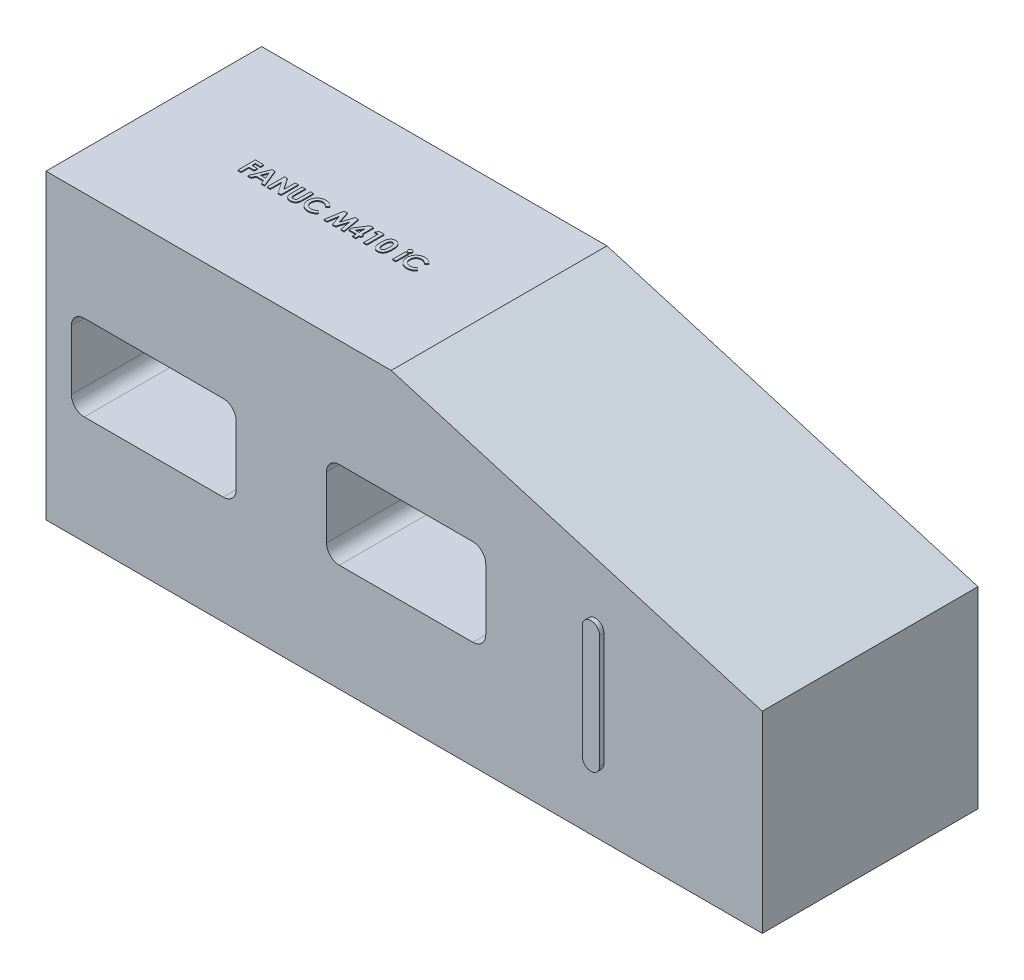
from build123d import *

# Parameters (mm, degrees)
SKETCH1_W           = 400
SKETCH1_H           = 250
BOSS_EXTRUDE1_DEPTH = 350
BOSS_EXTRUDE2_DEPTH = 250
BOSS_EXTRUDE3_DEPTH = 5
CUT_EXTRUDE1_DEPTH  = 490
SKETCH6_W           = 3.58974359
SKETCH6_H           = 14.615384616
BOSS_EXTRUDE4_DEPTH = 1


with BuildPart() as part:
    # Sketch1 → Boss-Extrude1 (new body)
    with BuildSketch(Plane(origin=(0, 0, 0), x_dir=(1, 0, 0), z_dir=(0, 1, 0))):
        with Locations((-200, 125)):
            Rectangle(SKETCH1_W, SKETCH1_H)
    extrude(amount=-BOSS_EXTRUDE1_DEPTH)

    # Sketch2 → Boss-Extrude2 (add)
    with BuildSketch(Plane.XY):
        Polygon((0, 0), (430, -127), (430, -350), (0, -350), align=None)
    extrude(amount=-BOSS_EXTRUDE2_DEPTH)

    # Sketch3 → Boss-Extrude3 (add)
    with BuildSketch(Plane.XY):
        with BuildLine():
            Line((246.478180257, -140.273477439), (246.478180257, -271.584843145))
            ThreePointArc((246.478180257, -271.584843145), (236.478180257, -281.584843145), (226.478180257, -271.584843145))
            Line((226.478180257, -271.584843145), (226.478180257, -140.273477439))
            ThreePointArc((226.478180257, -140.273477439), (236.478180257, -130.273477439), (246.478180257, -140.273477439))
        make_face()
    extrude(amount=BOSS_EXTRUDE3_DEPTH)

    # Sketch4 → Cut-Extrude1 (cut)
    with BuildSketch(Plane.XY):
        with BuildLine():
            Line((-355.609736241, -125.497461916), (-194.679619459, -125.497461916))
            ThreePointArc((-194.679619459, -125.497461916), (-184.073017741, -129.890860199), (-179.679619459, -140.497461916))
            Line((-179.679619459, -140.497461916), (-179.679619459, -209.502538084))
            ThreePointArc((-179.679619459, -209.502538084), (-184.073017741, -220.109139801), (-194.679619459, -224.502538084))
            Line((-194.679619459, -224.502538084), (-355.609736241, -224.502538084))
            ThreePointArc((-355.609736241, -224.502538084), (-366.216337958, -220.109139801), (-370.609736241, -209.502538084))
            Line((-370.609736241, -209.502538084), (-370.609736241, -140.497461916))
            ThreePointArc((-370.609736241, -140.497461916), (-366.216337958, -129.890860199), (-355.609736241, -125.497461916))
        make_face()
        with BuildLine():
            Line((-60.039815488, -124.499486523), (94.584219321, -124.499486523))
            ThreePointArc((94.584219321, -124.499486523), (105.190821039, -128.892884806), (109.584219321, -139.499486523))
            Line((109.584219321, -139.499486523), (109.584219321, -210.500513477))
            ThreePointArc((109.584219321, -210.500513477), (105.190821039, -221.107115194), (94.584219321, -225.500513477))
            Line((94.584219321, -225.500513477), (-60.039815488, -225.500513477))
            ThreePointArc((-60.039815488, -225.500513477), (-70.646417205, -221.107115194), (-75.039815488, -210.500513477))
            Line((-75.039815488, -210.500513477), (-75.039815488, -139.499486523))
            ThreePointArc((-75.039815488, -139.499486523), (-70.646417205, -128.892884806), (-60.039815488, -124.499486523))
        make_face()
    extrude(amount=-CUT_EXTRUDE1_DEPTH, mode=Mode.SUBTRACT)

    # Sketch6 → Boss-Extrude4 (add)
    # profile 1 of 12: a face of its own
    with BuildSketch(Plane(origin=(0, 0, 0), x_dir=(1, 0, 0), z_dir=(0, 1, 0))):
        Polygon((-288.973743059, 131.537887531), (-279.230153315, 131.537887531), (-279.230153315, 127.948143942), (-285.383999469, 127.948143942), (-285.383999469, 124.101990095), (-279.230153315, 124.101990095), (-279.230153315, 120.512246506), (-285.383999469, 120.512246506), (-285.383999469, 111.537887531), (-288.973743059, 111.537887531), align=None)
    # profile 2 of 12: a face of its own
    with BuildSketch(Plane(origin=(0, 0, 0), x_dir=(1, 0, 0), z_dir=(0, 1, 0))):
        Polygon((-269.482557162, 131.537887531), (-266.153230238, 131.537887531), (-258.076307162, 111.537887531), (-261.910441777, 111.537887531), (-263.464928956, 115.640451634), (-272.178871264, 115.640451634), (-273.733358444, 111.537887531), (-277.563486649, 111.537887531), align=None)
        Polygon((-267.819896905, 126.173304198), (-270.816691777, 119.230195224), (-264.823102033, 119.230195224), align=None, mode=Mode.SUBTRACT)
    # profile 3 of 12: a face of its own
    with BuildSketch(Plane(origin=(0, 0, 0), x_dir=(1, 0, 0), z_dir=(0, 1, 0))):
        Polygon((-255.127589213, 131.537887531), (-251.894416136, 131.537887531), (-242.819896905, 118.376829839), (-242.819896905, 131.537887531), (-239.230153315, 131.537887531), (-239.230153315, 111.537887531), (-242.487364854, 111.537887531), (-251.537845623, 124.658881121), (-251.537845623, 111.537887531), (-255.127589213, 111.537887531), align=None)
    # profile 4 of 12: a face of its own
    with BuildSketch(Plane(origin=(0, 0, 0), x_dir=(1, 0, 0), z_dir=(0, 1, 0))):
        with BuildLine():
            Line((-234.6147687, 131.537887531), (-231.02502511, 131.537887531))
            Line((-231.02502511, 131.537887531), (-231.02502511, 118.525067019))
            add(Edge.make_bspline(
                [(-231.02502511, 118.525067019), (-231.024829918, 118.39015574), (-231.024452905, 118.129575998), (-231.005579468, 117.755729384), (-230.988308972, 117.41208607), (-230.957148094, 117.099022273), (-230.911112798, 116.816404075), (-230.866535609, 116.562416037), (-230.806204792, 116.341605527), (-230.71553722, 116.090265358), (-230.575848255, 115.80787095), (-230.347604236, 115.513553019), (-230.084230164, 115.244945189), (-229.768561169, 115.021366208), (-229.413777136, 114.840510964), (-229.021827445, 114.706517243), (-228.593264605, 114.632034526), (-228.29693691, 114.620663375), (-228.144416136, 114.614810608)],
                knots=[0, 0, 0, 0, 1.155499968, 2.231836252, 3.205919964, 4.102923608, 4.924856345, 5.658536265, 6.31071849, 6.882491295, 7.94666036, 8.992281882, 10.060072772, 11.158554251, 12.289267114, 13.461410017, 14.693379945, 16, 16, 16, 16], degree=3))
            add(Edge.make_bspline(
                [(-228.144416136, 114.614810608), (-227.982381635, 114.619538892), (-227.666441793, 114.628758245), (-227.212012625, 114.719256177), (-226.790981425, 114.863359877), (-226.412262857, 115.069032582), (-226.076233809, 115.315567364), (-225.79179226, 115.596694273), (-225.567312035, 115.912974016), (-225.421004176, 116.204766163), (-225.338859518, 116.473335425), (-225.277288005, 116.713291869), (-225.232149275, 116.996416721), (-225.191197935, 117.318288376), (-225.166589334, 117.682240803), (-225.139905318, 118.085347051), (-225.130125379, 118.530365281), (-225.12845846, 118.840239826), (-225.127589213, 119.001829839)],
                knots=[0, 0, 0, 0, 1.261321664, 2.459363699, 3.594844139, 4.716940403, 5.803436589, 6.833651888, 7.818396249, 8.814403945, 9.360733334, 10.004355033, 10.743453831, 11.592799886, 12.532235708, 13.585170094, 14.740740724, 16, 16, 16, 16], degree=3))
            Line((-225.127589213, 119.001829839), (-225.127589213, 131.537887531))
            Line((-225.127589213, 131.537887531), (-221.537845623, 131.537887531))
            Line((-221.537845623, 131.537887531), (-221.537845623, 119.606797788))
            add(Edge.make_bspline(
                [(-221.537845623, 119.606797788), (-221.538344124, 119.36507448), (-221.539302693, 118.900264133), (-221.554023425, 118.232298955), (-221.585361199, 117.622219911), (-221.611681314, 117.069848738), (-221.662619751, 116.575929571), (-221.715685653, 116.138353234), (-221.78332271, 115.758670399), (-221.883962584, 115.326447633), (-222.057637212, 114.828758947), (-222.337623482, 114.255691999), (-222.69304793, 113.694624745), (-223.113141864, 113.151729312), (-223.587466344, 112.64739695), (-224.105504579, 112.204658416), (-224.65902623, 111.830149358), (-225.253815202, 111.533026974), (-225.889365298, 111.301293914), (-226.571964813, 111.14558097), (-227.301148268, 111.04037935), (-227.804809062, 111.03027344), (-228.064287931, 111.025067019)],
                knots=[0, 0, 0, 0, 1.170808336, 2.251350247, 3.235597562, 4.129743112, 4.929140599, 5.639994148, 6.264258765, 6.79612947, 7.788252245, 8.809469599, 9.879094798, 10.999557536, 12.129761673, 13.226370002, 14.293821979, 15.358369427, 16.438775801, 17.562147481, 18.744053101, 20, 20, 20, 20], degree=3))
            add(Edge.make_bspline(
                [(-228.064287931, 111.025067019), (-228.236690853, 111.027970918), (-228.576838282, 111.033700252), (-229.077084748, 111.084218014), (-229.560671225, 111.1586622), (-230.026689058, 111.267268601), (-230.476755706, 111.407567786), (-230.910751599, 111.580266312), (-231.327063901, 111.784400888), (-231.723362989, 112.018093919), (-232.099161182, 112.270792702), (-232.442621332, 112.550919941), (-232.76556271, 112.837759168), (-233.058655672, 113.143381795), (-233.324101609, 113.464579307), (-233.561353834, 113.802079642), (-233.77005987, 114.155852821), (-233.955469602, 114.532275586), (-234.114162237, 114.950480148), (-234.24794609, 115.425342213), (-234.364822812, 115.964304772), (-234.451678695, 116.568582078), (-234.530422749, 117.2361825), (-234.580263393, 117.96884524), (-234.606337278, 118.766591318), (-234.611887211, 119.319652136), (-234.6147687, 119.606797788)],
                knots=[0, 0, 0, 0, 1.001158378, 1.975264943, 2.917723546, 3.841610987, 4.75185031, 5.653588123, 6.552117133, 7.442167995, 8.324307438, 9.179605724, 10.014504199, 10.831958861, 11.636465792, 12.43274043, 13.225645099, 14.020104002, 14.867201867, 15.819789774, 16.883317127, 18.068162734, 19.364263498, 20.787406516, 22.332041935, 24, 24, 24, 24], degree=3))
            Line((-234.6147687, 119.606797788), (-234.6147687, 131.537887531))
        make_face()
    # profile 5 of 12: a face of its own
    with BuildSketch(Plane(origin=(0, 0, 0), x_dir=(1, 0, 0), z_dir=(0, 1, 0))):
        with BuildLine():
            Line((-198.973743059, 128.068336249), (-201.605954597, 125.552310608))
            add(Edge.make_bspline(
                [(-201.605954597, 125.552310608), (-201.829240224, 125.783188321), (-202.265387007, 126.234164825), (-202.968183606, 126.831217972), (-203.699066481, 127.328780987), (-204.443817763, 127.74782539), (-205.215833369, 128.064862346), (-206.006186697, 128.295892516), (-206.819924384, 128.436742879), (-207.370630752, 128.452858653), (-207.647621264, 128.460964454)],
                knots=[0, 0, 0, 0, 1.115251505, 2.178435587, 3.19620269, 4.182487026, 5.141301733, 6.088180966, 7.038406374, 8, 8, 8, 8], degree=3))
            add(Edge.make_bspline(
                [(-207.647621264, 128.460964454), (-207.878942003, 128.454560588), (-208.335427994, 128.441923263), (-209.00566905, 128.349279205), (-209.64678926, 128.191733952), (-210.260983279, 127.974607411), (-210.846443814, 127.69365719), (-211.404398356, 127.349100739), (-211.933471292, 126.944049891), (-212.426673875, 126.480600399), (-212.877838264, 125.974247003), (-213.27647073, 125.433969136), (-213.610389364, 124.861004546), (-213.884430955, 124.261155798), (-214.097898762, 123.631646493), (-214.250341595, 122.972900443), (-214.338510456, 122.284133132), (-214.351670249, 121.815914246), (-214.358358444, 121.577951634)],
                knots=[0, 0, 0, 0, 1.035432265, 2.043311493, 3.022114605, 3.98653278, 4.95457646, 5.923598177, 6.917315552, 7.932509744, 8.948865224, 9.949768934, 10.933144597, 11.912367597, 12.897413939, 13.903909035, 14.934704909, 16, 16, 16, 16], degree=3))
            add(Edge.make_bspline(
                [(-214.358358444, 121.577951634), (-214.356430982, 121.410932823), (-214.352631917, 121.081735316), (-214.311044423, 120.594760837), (-214.244078753, 120.122280466), (-214.147162837, 119.665009885), (-214.025968531, 119.22255282), (-213.883780014, 118.791092215), (-213.705406611, 118.376589885), (-213.507409443, 117.974231654), (-213.277141018, 117.59499637), (-213.028869177, 117.233364053), (-212.7596589, 116.891107389), (-212.467766496, 116.569625533), (-212.149083943, 116.273942527), (-211.811848005, 115.99516683), (-211.450369979, 115.740277144), (-211.072158681, 115.502876729), (-210.673946841, 115.29664497), (-210.26653887, 115.109838838), (-209.843757644, 114.958124485), (-209.410750776, 114.835828876), (-208.969065681, 114.731834725), (-208.514382268, 114.66780233), (-208.050642073, 114.619311347), (-207.73723154, 114.616317312), (-207.57951229, 114.614810608)],
                knots=[0, 0, 0, 0, 1.103660481, 2.175337485, 3.227646561, 4.255952547, 5.262355991, 6.258840057, 7.255597736, 8.242457506, 9.22035537, 10.185017736, 11.140346927, 12.096287581, 13.051739095, 14.01125915, 14.986044842, 15.97314143, 16.960198552, 17.947847494, 18.933482797, 19.925264591, 20.920966487, 21.929612487, 22.958107872, 24, 24, 24, 24], degree=3))
            add(Edge.make_bspline(
                [(-207.57951229, 114.614810608), (-207.311993336, 114.622548676), (-206.786388157, 114.637751967), (-206.014986981, 114.75663955), (-205.279918511, 114.952202896), (-204.692602322, 115.183151845), (-204.2324556, 115.411216929), (-203.882152703, 115.622165902), (-203.519912206, 115.858135488), (-203.151750612, 116.128031437), (-202.773526834, 116.428614888), (-202.391917395, 116.766469179), (-201.997153024, 117.130469254), (-201.738546798, 117.390263258), (-201.605954597, 117.523464454)],
                knots=[0, 0, 0, 0, 1.404581149, 2.759636711, 4.088442092, 5.392261763, 6.066678138, 6.783632037, 7.538459478, 8.336747902, 9.180226004, 10.074962426, 11.012997595, 12, 12, 12, 12], degree=3))
            Line((-201.605954597, 117.523464454), (-199.053871264, 114.843175993))
            add(Edge.make_bspline(
                [(-199.053871264, 114.843175993), (-199.233268986, 114.669973125), (-199.583414973, 114.331918167), (-200.111600474, 113.851911672), (-200.639121232, 113.420572476), (-201.153233446, 113.022244857), (-201.662358809, 112.668533066), (-202.16644333, 112.359083846), (-202.659780551, 112.086070778), (-203.152614777, 111.854098096), (-203.648012679, 111.657129196), (-204.157718902, 111.487551901), (-204.683291667, 111.344095611), (-205.227940933, 111.228345224), (-205.786586542, 111.135529041), (-206.364456677, 111.072878654), (-206.957887354, 111.030760883), (-207.360420576, 111.026976253), (-207.563486649, 111.025067019)],
                knots=[0, 0, 0, 0, 1.244526981, 2.429050516, 3.560637417, 4.644440555, 5.67424972, 6.652764056, 7.595344123, 8.486817594, 9.369275933, 10.254498637, 11.166417451, 12.086725134, 13.032340136, 13.991389299, 14.986715468, 16, 16, 16, 16], degree=3))
            add(Edge.make_bspline(
                [(-207.563486649, 111.025067019), (-207.936493871, 111.034575717), (-208.666365322, 111.053181595), (-209.735972903, 111.19103856), (-210.752071393, 111.422153334), (-211.717132769, 111.74901337), (-212.630850165, 112.166561747), (-213.492989824, 112.678456451), (-214.302162168, 113.283337458), (-215.051830677, 113.974114976), (-215.729941521, 114.737020755), (-216.329312979, 115.556172265), (-216.825113071, 116.435595336), (-217.236786571, 117.362298081), (-217.558709834, 118.340509404), (-217.785289236, 119.371287431), (-217.925019099, 120.453636883), (-217.940305745, 121.192906509), (-217.948102033, 121.569938813)],
                knots=[0, 0, 0, 0, 1.078019885, 2.10938526, 3.111377082, 4.085535484, 5.04941344, 6.010039228, 6.978205633, 7.964457913, 8.951525778, 9.924444315, 10.892603023, 11.863865945, 12.85144698, 13.863884204, 14.910567087, 16, 16, 16, 16], degree=3))
            add(Edge.make_bspline(
                [(-217.948102033, 121.569938813), (-217.9448077, 121.815836066), (-217.938279136, 122.303144321), (-217.869663322, 123.020988861), (-217.774008888, 123.720758885), (-217.622261827, 124.395188461), (-217.439345711, 125.0533634), (-217.211865488, 125.688130107), (-216.940184476, 126.301312968), (-216.633059593, 126.893938486), (-216.285612287, 127.46212433), (-215.897475502, 128.000988888), (-215.478641395, 128.514692095), (-215.019046063, 128.996418724), (-214.525368029, 129.450398429), (-213.995378393, 129.874171007), (-213.432264778, 130.273813834), (-212.834503045, 130.639021092), (-212.213706112, 130.969370469), (-211.577703862, 131.260752728), (-210.928058877, 131.504281197), (-210.267517917, 131.706279078), (-209.593290205, 131.857056213), (-208.910188205, 131.97118964), (-208.21239954, 132.034990956), (-207.743894903, 132.045435639), (-207.507396905, 132.050708044)],
                knots=[0, 0, 0, 0, 1.071919942, 2.124283339, 3.142214191, 4.149696895, 5.136002878, 6.119640489, 7.086990633, 8.058538607, 9.028339693, 9.988281803, 10.952401235, 11.916291999, 12.888973767, 13.874849856, 14.873389453, 15.898127285, 16.927174885, 17.938320013, 18.946391617, 19.950418109, 20.947802303, 21.956882652, 22.968648068, 24, 24, 24, 24], degree=3))
            add(Edge.make_bspline(
                [(-207.507396905, 132.050708044), (-207.305639864, 132.04768577), (-206.904223493, 132.041672644), (-206.306447156, 131.991546698), (-205.713451554, 131.912824408), (-205.127359794, 131.794049236), (-204.543979548, 131.653048097), (-203.970977086, 131.468426556), (-203.399312984, 131.262631056), (-202.837952946, 131.016644556), (-202.286113394, 130.748128072), (-201.75672204, 130.44348637), (-201.240890451, 130.121466759), (-200.750049146, 129.763010709), (-200.275003611, 129.381120086), (-199.818237899, 128.974013157), (-199.383760397, 128.534902253), (-199.111106441, 128.224644479), (-198.973743059, 128.068336249)],
                knots=[0, 0, 0, 0, 0.996412454, 1.982464992, 2.961075852, 3.949442424, 4.934965278, 5.923860011, 6.921385422, 7.934793307, 8.949617135, 9.951082467, 10.950285876, 11.951772932, 12.951063433, 13.960125323, 14.972308753, 16, 16, 16, 16], degree=3))
        make_face()
    # profile 6 of 12: a face of its own
    with BuildSketch(Plane(origin=(0, 0, 0), x_dir=(1, 0, 0), z_dir=(0, 1, 0))):
        Polygon((-186.109159726, 131.537887531), (-182.383198187, 131.537887531), (-177.819896905, 117.587567019), (-173.224544341, 131.537887531), (-169.534640495, 131.537887531), (-166.153230238, 111.537887531), (-169.787044341, 111.537887531), (-171.922461008, 124.17009907), (-176.081114854, 111.537887531), (-179.582717418, 111.537887531), (-183.717332803, 124.17009907), (-185.848743059, 111.537887531), (-189.486563572, 111.537887531), align=None)
    # profile 7 of 12: a face of its own
    with BuildSketch(Plane(origin=(0, 0, 0), x_dir=(1, 0, 0), z_dir=(0, 1, 0))):
        Polygon((-156.305473828, 132.050708044), (-152.563486649, 132.050708044), (-152.563486649, 118.973784967), (-150.768614854, 118.973784967), (-150.768614854, 115.640451634), (-152.563486649, 115.640451634), (-152.563486649, 111.537887531), (-156.153230238, 111.537887531), (-156.153230238, 115.640451634), (-164.6147687, 115.640451634), (-164.6147687, 119.274265737), align=None)
        Polygon((-156.153230238, 118.973784967), (-156.153230238, 125.780675993), (-160.580313572, 118.973784967), align=None, mode=Mode.SUBTRACT)
    # profile 8 of 12: a face of its own
    with BuildSketch(Plane(origin=(0, 0, 0), x_dir=(1, 0, 0), z_dir=(0, 1, 0))):
        Polygon((-145.291852033, 131.537887531), (-139.742973828, 131.537887531), (-139.742973828, 111.537887531), (-143.332717418, 111.537887531), (-143.332717418, 128.204554198), (-147.435281521, 128.204554198), align=None)
    # profile 9 of 12: a face of its own
    with BuildSketch(Plane(origin=(0, 0, 0), x_dir=(1, 0, 0), z_dir=(0, 1, 0))):
        with BuildLine():
            add(Edge.make_bspline(
                [(-126.854352033, 132.050708044), (-126.680593544, 132.04812855), (-126.33893793, 132.043056577), (-125.835743522, 131.988122968), (-125.351028183, 131.905133606), (-124.882895645, 131.789392385), (-124.434715575, 131.636213002), (-124.003226025, 131.452859906), (-123.59356297, 131.229715849), (-123.200501897, 130.977663177), (-122.824194213, 130.69230382), (-122.473684209, 130.36697942), (-122.14257083, 130.009175703), (-121.83802146, 129.613483321), (-121.55329176, 129.183501513), (-121.289317304, 128.7191621), (-121.048118883, 128.218192451), (-120.826993238, 127.679688525), (-120.629261987, 127.095578383), (-120.4627132, 126.459162027), (-120.319869746, 125.77029412), (-120.199299792, 125.027259966), (-120.108168394, 124.229071895), (-120.046743998, 123.376260183), (-120.004591669, 122.470468927), (-120.00115149, 121.849103567), (-119.999384085, 121.529874711)],
                knots=[0, 0, 0, 0, 0.879237366, 1.728815576, 2.559023295, 3.367336655, 4.166867292, 4.954216142, 5.737608147, 6.525189134, 7.316157332, 8.124696809, 8.942788509, 9.781158001, 10.649253743, 11.551476218, 12.482711956, 13.461909668, 14.496590415, 15.601789533, 16.789733467, 18.056700938, 19.410929216, 20.8549011, 22.384193279, 24, 24, 24, 24], degree=3))
            add(Edge.make_bspline(
                [(-119.999384085, 121.529874711), (-120.001294172, 121.206651943), (-120.005005438, 120.578635902), (-120.044991713, 119.664559818), (-120.113849968, 118.805556182), (-120.202599455, 118.001713862), (-120.324161977, 117.253457356), (-120.466528589, 116.558849182), (-120.635706298, 115.918141117), (-120.839950753, 115.332776815), (-121.05973792, 114.793327159), (-121.301596122, 114.293334282), (-121.561309805, 113.831443925), (-121.832921921, 113.400687844), (-122.131323243, 113.013764511), (-122.441989738, 112.657516508), (-122.778448382, 112.345513779), (-123.126532963, 112.061677104), (-123.498995228, 111.816385255), (-123.891994071, 111.601857049), (-124.312535981, 111.427849194), (-124.752955192, 111.276506456), (-125.220758739, 111.1678587), (-125.70851329, 111.081650276), (-126.221725493, 111.034006213), (-126.571141032, 111.028095654), (-126.750185367, 111.025067019)],
                knots=[0, 0, 0, 0, 1.643780988, 3.193836972, 4.651895693, 6.025988579, 7.305620092, 8.505800249, 9.631074763, 10.672816429, 11.65661981, 12.592235626, 13.49536222, 14.350718032, 15.179365177, 15.97804903, 16.751647189, 17.51006938, 18.259804725, 19.016521909, 19.783502495, 20.571750527, 21.382245291, 22.22305063, 23.089471752, 24, 24, 24, 24], degree=3))
            add(Edge.make_bspline(
                [(-126.750185367, 111.025067019), (-126.929224869, 111.028154074), (-127.279960622, 111.03420157), (-127.794560601, 111.081296022), (-128.284900006, 111.168207932), (-128.756404631, 111.277340573), (-129.20579288, 111.427514333), (-129.635219556, 111.606728379), (-130.041382738, 111.819918036), (-130.425407029, 112.065781391), (-130.785981261, 112.347718984), (-131.128708756, 112.662715177), (-131.452831379, 113.009971536), (-131.753418422, 113.393377618), (-132.035392632, 113.807815753), (-132.295813462, 114.258018621), (-132.534524408, 114.74333074), (-132.758992391, 115.264428583), (-132.954026655, 115.83253079), (-133.127598094, 116.452710441), (-133.269783251, 117.130137245), (-133.384138069, 117.864593573), (-133.47543889, 118.654523445), (-133.543356207, 119.500308138), (-133.583564587, 120.402341599), (-133.587236933, 121.022354129), (-133.589127674, 121.341573429)],
                knots=[0, 0, 0, 0, 0.917216111, 1.796812873, 2.643793957, 3.46689424, 4.273913431, 5.068098542, 5.848489301, 6.620921603, 7.401012384, 8.190319798, 9.003608147, 9.831726257, 10.68377682, 11.569763213, 12.493818149, 13.453288342, 14.474581811, 15.568529029, 16.750744269, 18.018426408, 19.375425659, 20.823733699, 22.36466933, 24, 24, 24, 24], degree=3))
            add(Edge.make_bspline(
                [(-133.589127674, 121.341573429), (-133.585702772, 121.785103516), (-133.57909438, 122.640900533), (-133.495347978, 123.8772784), (-133.372429501, 125.020095566), (-133.191891374, 126.06744038), (-132.968658477, 127.023191901), (-132.682797129, 127.88105414), (-132.357364779, 128.652897542), (-132.080054608, 129.110142221), (-131.946499469, 129.33035548)],
                knots=[0, 0, 0, 0, 1.288568992, 2.486310467, 3.599230591, 4.627010532, 5.572937695, 6.447898582, 7.252493626, 8, 8, 8, 8], degree=3))
            add(Edge.make_bspline(
                [(-131.946499469, 129.33035548), (-131.791207915, 129.546692917), (-131.487582327, 129.969675235), (-130.9566845, 130.524971953), (-130.386303906, 130.999888898), (-129.764725254, 131.383678275), (-129.101779069, 131.686334608), (-128.391773621, 131.900097368), (-127.63733084, 132.024645512), (-127.119242398, 132.041890802), (-126.854352033, 132.050708044)],
                knots=[0, 0, 0, 0, 1.058512271, 2.069600068, 3.047294572, 4.004278952, 4.967380941, 5.939006123, 6.946246673, 8, 8, 8, 8], degree=3))
        make_face()
        with BuildLine():
            add(Edge.make_bspline(
                [(-126.766211008, 128.460964454), (-126.923290123, 128.453519217), (-127.23124857, 128.438922599), (-127.678110951, 128.315017904), (-128.099474276, 128.123640423), (-128.419994103, 127.893347546), (-128.659900005, 127.672584207), (-128.827523979, 127.472800564), (-128.989170884, 127.249856418), (-129.131945569, 126.993691444), (-129.266762142, 126.713509953), (-129.398518571, 126.40804009), (-129.506524245, 126.069778853), (-129.612636956, 125.704486875), (-129.705601593, 125.302064802), (-129.783485577, 124.85922328), (-129.853068072, 124.373082468), (-129.901602691, 123.843323943), (-129.946851522, 123.270501965), (-129.979288027, 122.653340506), (-129.992848915, 121.992006066), (-129.997159509, 121.536554851), (-129.999384085, 121.301509326)],
                knots=[0, 0, 0, 0, 1.076674018, 2.110852608, 3.161083442, 4.239746716, 4.804137807, 5.395870207, 6.026861976, 6.692161227, 7.405688833, 8.16177676, 8.973626916, 9.841385931, 10.773283133, 11.807421078, 12.927755683, 14.143907515, 15.458935494, 16.872852025, 18.386167141, 20, 20, 20, 20], degree=3))
            add(Edge.make_bspline(
                [(-129.999384085, 121.301509326), (-129.995722703, 120.996996486), (-129.988701731, 120.413070539), (-129.951929165, 119.573364693), (-129.878221607, 118.809164759), (-129.786544287, 118.11529147), (-129.657779748, 117.49624478), (-129.50962781, 116.946167933), (-129.326673339, 116.472073073), (-129.115234197, 116.067103723), (-128.88105582, 115.722597139), (-128.626844889, 115.42976499), (-128.361256378, 115.176186165), (-128.076000404, 114.97020721), (-127.771757502, 114.812354435), (-127.451067543, 114.698812882), (-127.11372673, 114.62930937), (-126.88271922, 114.619671467), (-126.766211008, 114.614810608)],
                knots=[0, 0, 0, 0, 1.771748488, 3.397459088, 4.888034009, 6.237357457, 7.467047327, 8.564189669, 9.548206622, 10.417051504, 11.216568818, 11.965764335, 12.669334354, 13.348544111, 14.005342236, 14.656555988, 15.322436492, 16, 16, 16, 16], degree=3))
            add(Edge.make_bspline(
                [(-126.766211008, 114.614810608), (-126.653700988, 114.618136769), (-126.433420361, 114.624648978), (-126.112201872, 114.691495925), (-125.808434844, 114.800174542), (-125.523036445, 114.953908075), (-125.254985844, 115.149403785), (-125.005593107, 115.387520762), (-124.776739105, 115.670632478), (-124.643407724, 115.880743243), (-124.574704597, 115.989009326)],
                knots=[0, 0, 0, 0, 0.992283464, 1.942767638, 2.88273346, 3.832339453, 4.79467288, 5.803907806, 6.868395428, 8, 8, 8, 8], degree=3))
            add(Edge.make_bspline(
                [(-124.574704597, 115.989009326), (-124.493818237, 116.136951469), (-124.324206098, 116.447174146), (-124.127930638, 116.970663346), (-123.962716896, 117.561072642), (-123.820519843, 118.220239445), (-123.723265734, 118.950763589), (-123.639510613, 119.748012759), (-123.599113437, 120.616001577), (-123.592542617, 121.217347362), (-123.589127674, 121.529874711)],
                knots=[0, 0, 0, 0, 0.710965849, 1.490837728, 2.352621235, 3.297892224, 4.334225155, 5.461620853, 6.680770821, 8, 8, 8, 8], degree=3))
            add(Edge.make_bspline(
                [(-123.589127674, 121.529874711), (-123.590446793, 121.845114948), (-123.592985871, 122.451898591), (-123.639570596, 123.32300789), (-123.704443386, 124.118621661), (-123.799333549, 124.836963623), (-123.921426991, 125.479777595), (-124.07190762, 126.047021555), (-124.249313087, 126.539813432), (-124.459694829, 126.957661845), (-124.692705679, 127.312775677), (-124.94005381, 127.6174358), (-125.20278511, 127.877546926), (-125.480460207, 128.0940879), (-125.779505988, 128.259541445), (-126.094210288, 128.376365334), (-126.425218276, 128.44703987), (-126.651012584, 128.456260277), (-126.766211008, 128.460964454)],
                knots=[0, 0, 0, 0, 1.793836731, 3.452829483, 4.963243077, 6.335886805, 7.574563692, 8.684454726, 9.672768357, 10.54971625, 11.340229787, 12.085688095, 12.778991901, 13.440269426, 14.083255152, 14.715733572, 15.344777694, 16, 16, 16, 16], degree=3))
        make_face(mode=Mode.SUBTRACT)
    # profile 10 of 12: a face of its own
    with BuildSketch(Plane(origin=(0, 0, 0), x_dir=(1, 0, 0), z_dir=(0, 1, 0))):
        with BuildLine():
            add(Edge.make_bspline(
                [(-107.956114854, 132.307118301), (-107.80139693, 132.299527254), (-107.497593381, 132.284621502), (-107.062353456, 132.139323578), (-106.662891412, 131.911282828), (-106.309755887, 131.598405484), (-106.016050779, 131.224772708), (-105.791649168, 130.806465975), (-105.666644379, 130.342995587), (-105.649283063, 130.02283509), (-105.640409726, 129.859201634)],
                knots=[0, 0, 0, 0, 0.989868614, 1.943702388, 2.910836514, 3.924849579, 4.949916355, 5.946401046, 6.950409252, 8, 8, 8, 8], degree=3))
            add(Edge.make_bspline(
                [(-105.640409726, 129.859201634), (-105.64896559, 129.696774066), (-105.6656371, 129.380276215), (-105.794526231, 128.923097653), (-106.00992114, 128.504994092), (-106.306005076, 128.136910457), (-106.65531215, 127.829072187), (-107.046045642, 127.596891495), (-107.477114708, 127.459676462), (-107.776204143, 127.443524672), (-107.928069982, 127.435323429)],
                knots=[0, 0, 0, 0, 1.05296456, 2.051751585, 3.055639087, 4.085634717, 5.099016424, 6.062201612, 7.016062274, 8, 8, 8, 8], degree=3))
            add(Edge.make_bspline(
                [(-107.928069982, 127.435323429), (-108.084138465, 127.442887339), (-108.390585092, 127.457739376), (-108.829394882, 127.603377263), (-109.234184728, 127.829622044), (-109.585788353, 128.148891958), (-109.882857041, 128.525179677), (-110.097456701, 128.953224953), (-110.231694097, 129.419864541), (-110.247627957, 129.744766831), (-110.255794341, 129.911284967)],
                knots=[0, 0, 0, 0, 0.989065327, 1.942068821, 2.907541208, 3.917690034, 4.939857478, 5.938239964, 6.943311734, 8, 8, 8, 8], degree=3))
            add(Edge.make_bspline(
                [(-110.255794341, 129.911284967), (-110.246907083, 130.070954418), (-110.229449347, 130.384602005), (-110.103695765, 130.837768088), (-109.884439676, 131.249042431), (-109.592850155, 131.615835508), (-109.242816348, 131.922876513), (-108.843594108, 132.143991516), (-108.411283362, 132.283288222), (-108.1094043, 132.299092922), (-107.956114854, 132.307118301)],
                knots=[0, 0, 0, 0, 1.038616768, 2.040212704, 3.031499824, 4.052181184, 5.074969369, 6.039807101, 7.004644834, 8, 8, 8, 8], degree=3))
        make_face()
    # profile 11 of 12: a face of its own
    with BuildSketch(Plane(origin=(0, 0, 0), x_dir=(1, 0, 0), z_dir=(0, 1, 0))):
        with Locations((-107.948102033, 118.845579839)):
            Rectangle(SKETCH6_W, SKETCH6_H)
    # profile 12 of 12: a face of its own
    with BuildSketch(Plane(origin=(0, 0, 0), x_dir=(1, 0, 0), z_dir=(0, 1, 0))):
        with BuildLine():
            Line((-84.358358444, 128.068336249), (-86.990569982, 125.552310608))
            add(Edge.make_bspline(
                [(-86.990569982, 125.552310608), (-87.213855609, 125.783188321), (-87.650002391, 126.234164825), (-88.352798991, 126.831217972), (-89.083681866, 127.328780987), (-89.828433148, 127.74782539), (-90.600448754, 128.064862346), (-91.390802081, 128.295892516), (-92.204539769, 128.436742879), (-92.755246137, 128.452858653), (-93.032236649, 128.460964454)],
                knots=[0, 0, 0, 0, 1.115251505, 2.178435587, 3.19620269, 4.182487026, 5.141301733, 6.088180966, 7.038406374, 8, 8, 8, 8], degree=3))
            add(Edge.make_bspline(
                [(-93.032236649, 128.460964454), (-93.263557387, 128.454560588), (-93.720043378, 128.441923263), (-94.390284435, 128.349279205), (-95.031404645, 128.191733952), (-95.645598663, 127.974607411), (-96.231059198, 127.69365719), (-96.789013741, 127.349100739), (-97.318086677, 126.944049891), (-97.811289259, 126.480600399), (-98.262453649, 125.974247003), (-98.661086114, 125.433969136), (-98.995004749, 124.861004546), (-99.26904634, 124.261155798), (-99.482514146, 123.631646493), (-99.63495698, 122.972900443), (-99.723125841, 122.284133132), (-99.736285634, 121.815914246), (-99.742973828, 121.577951634)],
                knots=[0, 0, 0, 0, 1.035432265, 2.043311493, 3.022114605, 3.98653278, 4.95457646, 5.923598177, 6.917315552, 7.932509744, 8.948865224, 9.949768934, 10.933144597, 11.912367597, 12.897413939, 13.903909035, 14.934704909, 16, 16, 16, 16], degree=3))
            add(Edge.make_bspline(
                [(-99.742973828, 121.577951634), (-99.741046367, 121.410932823), (-99.737247301, 121.081735316), (-99.695659808, 120.594760837), (-99.628694137, 120.122280466), (-99.531778221, 119.665009885), (-99.410583915, 119.22255282), (-99.268395398, 118.791092215), (-99.090021996, 118.376589885), (-98.892024828, 117.974231654), (-98.661756402, 117.59499637), (-98.413484561, 117.233364053), (-98.144274284, 116.891107389), (-97.85238188, 116.569625533), (-97.533699327, 116.273942527), (-97.19646339, 115.99516683), (-96.834985364, 115.740277144), (-96.456774065, 115.502876729), (-96.058562225, 115.29664497), (-95.651154255, 115.109838838), (-95.228373028, 114.958124485), (-94.79536616, 114.835828876), (-94.353681065, 114.731834725), (-93.898997653, 114.66780233), (-93.435257458, 114.619311347), (-93.121846925, 114.616317312), (-92.964127674, 114.614810608)],
                knots=[0, 0, 0, 0, 1.103660481, 2.175337485, 3.227646561, 4.255952547, 5.262355991, 6.258840057, 7.255597736, 8.242457506, 9.22035537, 10.185017736, 11.140346927, 12.096287581, 13.051739095, 14.01125915, 14.986044842, 15.97314143, 16.960198552, 17.947847494, 18.933482797, 19.925264591, 20.920966487, 21.929612487, 22.958107872, 24, 24, 24, 24], degree=3))
            add(Edge.make_bspline(
                [(-92.964127674, 114.614810608), (-92.69660872, 114.622548676), (-92.171003541, 114.637751967), (-91.399602366, 114.75663955), (-90.664533896, 114.952202896), (-90.077217706, 115.183151845), (-89.617070985, 115.411216929), (-89.266768088, 115.622165902), (-88.90452759, 115.858135488), (-88.536365996, 116.128031437), (-88.158142219, 116.428614888), (-87.776532779, 116.766469179), (-87.381768408, 117.130469254), (-87.123162182, 117.390263258), (-86.990569982, 117.523464454)],
                knots=[0, 0, 0, 0, 1.404581149, 2.759636711, 4.088442092, 5.392261763, 6.066678138, 6.783632037, 7.538459478, 8.336747902, 9.180226004, 10.074962426, 11.012997595, 12, 12, 12, 12], degree=3))
            Line((-86.990569982, 117.523464454), (-84.438486649, 114.843175993))
            add(Edge.make_bspline(
                [(-84.438486649, 114.843175993), (-84.61788437, 114.669973125), (-84.968030357, 114.331918167), (-85.496215858, 113.851911672), (-86.023736617, 113.420572476), (-86.537848831, 113.022244857), (-87.046974194, 112.668533066), (-87.551058714, 112.359083846), (-88.044395935, 112.086070778), (-88.537230162, 111.854098096), (-89.032628063, 111.657129196), (-89.542334287, 111.487551901), (-90.067907052, 111.344095611), (-90.612556317, 111.228345224), (-91.171201927, 111.135529041), (-91.749072061, 111.072878654), (-92.342502738, 111.030760883), (-92.74503596, 111.026976253), (-92.948102033, 111.025067019)],
                knots=[0, 0, 0, 0, 1.244526981, 2.429050516, 3.560637417, 4.644440555, 5.67424972, 6.652764056, 7.595344123, 8.486817594, 9.369275933, 10.254498637, 11.166417451, 12.086725134, 13.032340136, 13.991389299, 14.986715468, 16, 16, 16, 16], degree=3))
            add(Edge.make_bspline(
                [(-92.948102033, 111.025067019), (-93.321109256, 111.034575717), (-94.050980707, 111.053181595), (-95.120588288, 111.19103856), (-96.136686778, 111.422153334), (-97.101748154, 111.74901337), (-98.01546555, 112.166561747), (-98.877605208, 112.678456451), (-99.686777552, 113.283337458), (-100.436446061, 113.974114976), (-101.114556906, 114.737020755), (-101.713928363, 115.556172265), (-102.209728456, 116.435595336), (-102.621401956, 117.362298081), (-102.943325218, 118.340509404), (-103.16990462, 119.371287431), (-103.309634484, 120.453636883), (-103.32492113, 121.192906509), (-103.332717418, 121.569938813)],
                knots=[0, 0, 0, 0, 1.078019885, 2.10938526, 3.111377082, 4.085535484, 5.04941344, 6.010039228, 6.978205633, 7.964457913, 8.951525778, 9.924444315, 10.892603023, 11.863865945, 12.85144698, 13.863884204, 14.910567087, 16, 16, 16, 16], degree=3))
            add(Edge.make_bspline(
                [(-103.332717418, 121.569938813), (-103.329423084, 121.815836066), (-103.32289452, 122.303144321), (-103.254278707, 123.020988861), (-103.158624273, 123.720758885), (-103.006877211, 124.395188461), (-102.823961095, 125.0533634), (-102.596480873, 125.688130107), (-102.324799861, 126.301312968), (-102.017674978, 126.893938486), (-101.670227671, 127.46212433), (-101.282090887, 128.000988888), (-100.863256779, 128.514692095), (-100.403661447, 128.996418724), (-99.909983413, 129.450398429), (-99.379993777, 129.874171007), (-98.816880163, 130.273813834), (-98.21911843, 130.639021092), (-97.598321497, 130.969370469), (-96.962319246, 131.260752728), (-96.312674262, 131.504281197), (-95.652133302, 131.706279078), (-94.977905589, 131.857056213), (-94.294803589, 131.97118964), (-93.597014925, 132.034990956), (-93.128510288, 132.045435639), (-92.89201229, 132.050708044)],
                knots=[0, 0, 0, 0, 1.071919942, 2.124283339, 3.142214191, 4.149696895, 5.136002878, 6.119640489, 7.086990633, 8.058538607, 9.028339693, 9.988281803, 10.952401235, 11.916291999, 12.888973767, 13.874849856, 14.873389453, 15.898127285, 16.927174885, 17.938320013, 18.946391617, 19.950418109, 20.947802303, 21.956882652, 22.968648068, 24, 24, 24, 24], degree=3))
            add(Edge.make_bspline(
                [(-92.89201229, 132.050708044), (-92.690255248, 132.04768577), (-92.288838877, 132.041672644), (-91.69106254, 131.991546698), (-91.098066939, 131.912824408), (-90.511975178, 131.794049236), (-89.928594932, 131.653048097), (-89.35559247, 131.468426556), (-88.783928369, 131.262631056), (-88.222568331, 131.016644556), (-87.670728779, 130.748128072), (-87.141337425, 130.44348637), (-86.625505836, 130.121466759), (-86.134664531, 129.763010709), (-85.659618995, 129.381120086), (-85.202853283, 128.974013157), (-84.768375781, 128.534902253), (-84.495721825, 128.224644479), (-84.358358444, 128.068336249)],
                knots=[0, 0, 0, 0, 0.996412454, 1.982464992, 2.961075852, 3.949442424, 4.934965278, 5.923860011, 6.921385422, 7.934793307, 8.949617135, 9.951082467, 10.950285876, 11.951772932, 12.951063433, 13.960125323, 14.972308753, 16, 16, 16, 16], degree=3))
        make_face()
    extrude(amount=BOSS_EXTRUDE4_DEPTH)


solid = part.part
